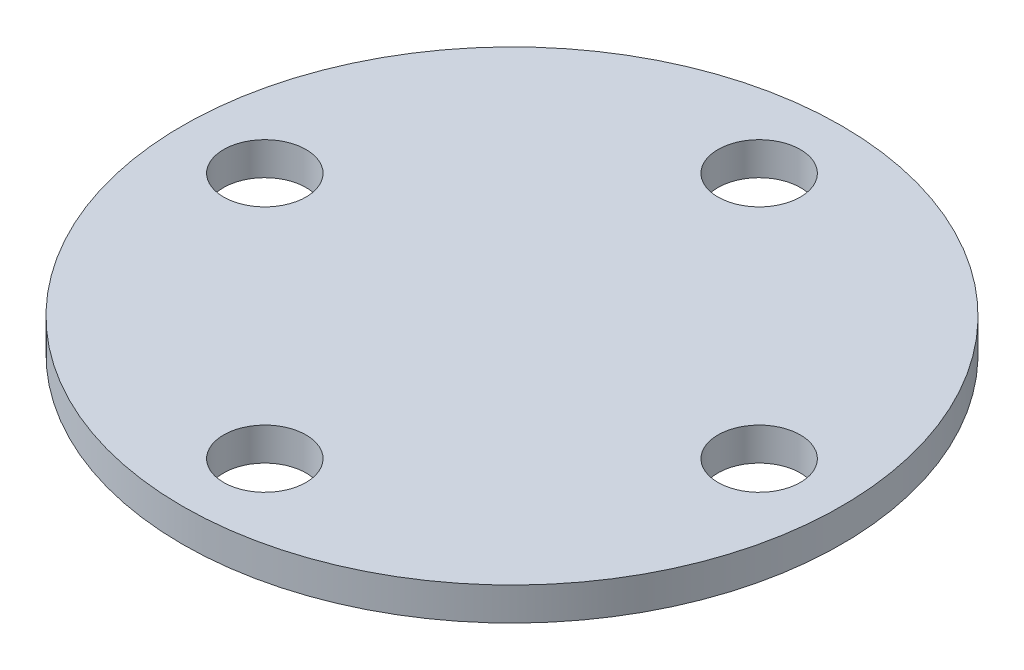
from build123d import *

# Parameters (mm, degrees)
SKETCH1_R           = 25.4
SKETCH1_R_2         = 3.175
BOSS_EXTRUDE1_DEPTH = 2.54


with BuildPart() as part:
    # Sketch1 → Boss-Extrude1 (new body)
    with BuildSketch(Plane(origin=(0, 0, 0), x_dir=(1, 0, 0), z_dir=(0, 1, 0))):
        with Locations(Location((0, 0, 0), (0, 0, 270))):
            Circle(SKETCH1_R)
        with Locations(Location((0, 19.05, 0), (0, 0, 270))):
            Circle(SKETCH1_R_2, mode=Mode.SUBTRACT)
        with Locations(Location((19.05, 0, 0), (0, 0, 270))):
            Circle(SKETCH1_R_2, mode=Mode.SUBTRACT)
        with Locations(Location((0, -19.05, 0), (0, 0, 270))):
            Circle(SKETCH1_R_2, mode=Mode.SUBTRACT)
        with Locations(Location((-19.05, 0, 0), (0, 0, 270))):
            Circle(SKETCH1_R_2, mode=Mode.SUBTRACT)
    extrude(amount=BOSS_EXTRUDE1_DEPTH)


solid = part.part
